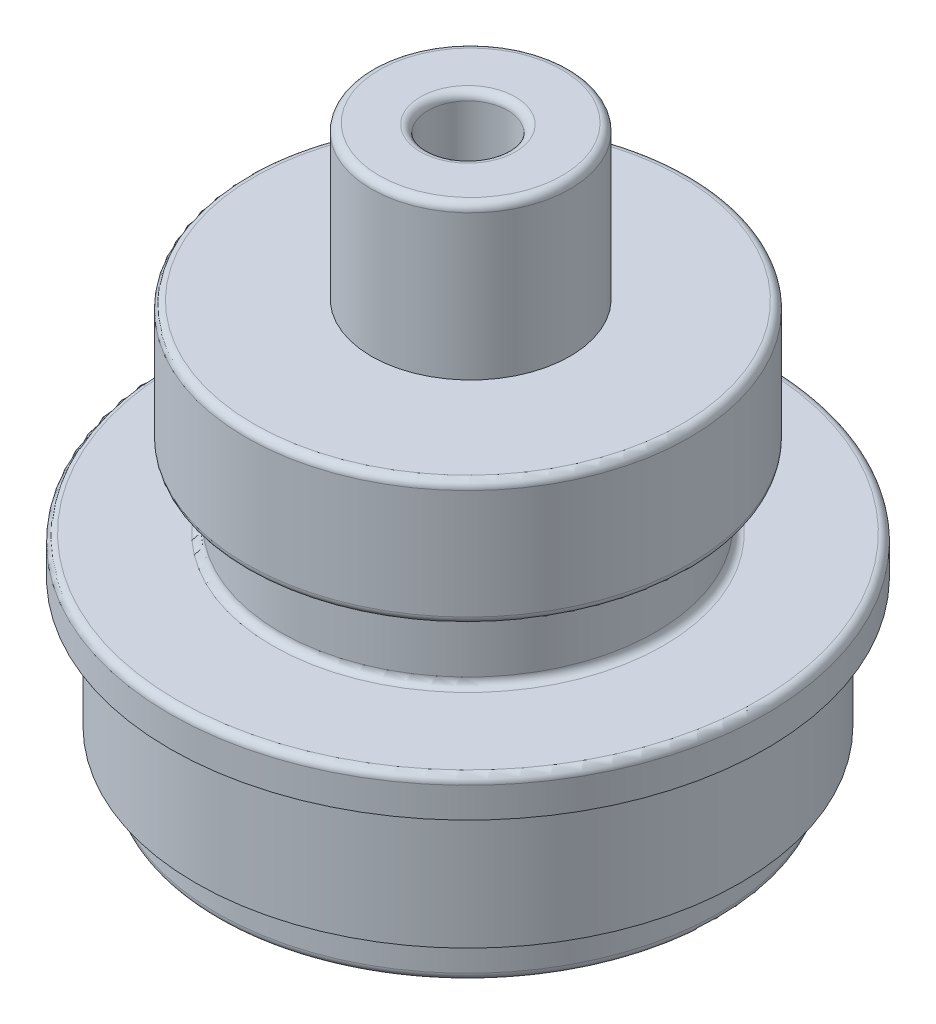
from build123d import *

# Parameters (mm, degrees)
SKETCH1_R           = 38.1
BOSS_EXTRUDE4_DEPTH = 4.8514
SKETCH5_R           = 23.9776
BOSS_EXTRUDE5_DEPTH = 9.7282
SKETCH6_R           = 28.3464
BOSS_EXTRUDE6_DEPTH = 16.002
SKETCH7_R           = 12.7
BOSS_EXTRUDE7_DEPTH = 19.5072
SKETCH8_R           = 34.798
BOSS_EXTRUDE8_DEPTH = 16.51
SKETCH9_R           = 32.0675
BOSS_EXTRUDE9_DEPTH = 5.715
SKETCH10_R          = 19.05
CUT_EXTRUDE1_DEPTH  = 38.1
SKETCH11_R          = 5.08
CUT_EXTRUDE2_DEPTH  = 29.718
FILLET1_R           = 1


with BuildPart() as part:
    # Sketch1 → Boss-Extrude4 (new body)
    with BuildSketch(Plane(origin=(0, 0, 0), x_dir=(1, 0, 0), z_dir=(0, 1, 0))):
        with Locations(Location((0, 0, 0), (0, 0, 270))):
            Circle(SKETCH1_R)
    extrude(amount=BOSS_EXTRUDE4_DEPTH)

    # Sketch5 → Boss-Extrude5 (add)
    with BuildSketch(Plane(origin=(0, 4.8514, 0), x_dir=(1, 0, 0), z_dir=(0, 1, 0))):
        with Locations(Location((0, 0, 0), (0, 0, 270))):
            Circle(SKETCH5_R)
    extrude(amount=BOSS_EXTRUDE5_DEPTH)

    # Sketch6 → Boss-Extrude6 (add)
    with BuildSketch(Plane(origin=(0, 14.5796, 0), x_dir=(1, 0, 0), z_dir=(0, 1, 0))):
        with Locations(Location((0, 0, 0), (0, 0, 270))):
            Circle(SKETCH6_R)
    extrude(amount=BOSS_EXTRUDE6_DEPTH)

    # Sketch7 → Boss-Extrude7 (add)
    with BuildSketch(Plane(origin=(0, 30.5816, 0), x_dir=(1, 0, 0), z_dir=(0, 1, 0))):
        with Locations(Location((0, 0.352964288, 0), (0, 0, 270))):
            Circle(SKETCH7_R)
    extrude(amount=BOSS_EXTRUDE7_DEPTH)

    # Sketch8 → Boss-Extrude8 (add)
    with BuildSketch(Plane.XZ):
        with Locations(Location((0, 0, 0), (0, 0, 270))):
            Circle(SKETCH8_R)
    extrude(amount=BOSS_EXTRUDE8_DEPTH)

    # Sketch9 → Boss-Extrude9 (add)
    with BuildSketch(Plane.XZ.offset(16.51)):
        with Locations(Location((0, 0, 0), (0, 0, 270))):
            Circle(SKETCH9_R)
    extrude(amount=BOSS_EXTRUDE9_DEPTH)

    # Sketch10 → Cut-Extrude1 (cut)
    with BuildSketch(Plane.XZ.offset(22.225)):
        with Locations(Location((0, 0, 0), (0, 0, 270))):
            Circle(SKETCH10_R)
    extrude(amount=-CUT_EXTRUDE1_DEPTH, mode=Mode.SUBTRACT)

    # Sketch11 → Cut-Extrude2 (cut)
    with BuildSketch(Plane(origin=(0, 50.0888, 0), x_dir=(1, 0, 0), z_dir=(0, 1, 0))):
        with Locations(Location((0, 0, 0), (0, 0, 270))):
            Circle(SKETCH11_R)
    extrude(amount=-CUT_EXTRUDE2_DEPTH, mode=Mode.SUBTRACT)

    # Fillet1
    fillet1_edges = [part.edges().sort_by_distance(p)[0] for p in [
        (0, 14.5796, -28.3464),
        (0, 30.5816, -28.3464),
        (0, 50.0888, -13.052964288),
        (0, -22.225, 32.0675),
        (0, -22.225, 19.05),
        (0, 50.0888, -5.08),
        (0, 4.8514, -38.1),
        (0, 4.8514, -23.9776),
        (0, 14.5796, -23.9776),
    ]]
    fillet(fillet1_edges, radius=FILLET1_R)


solid = part.part
